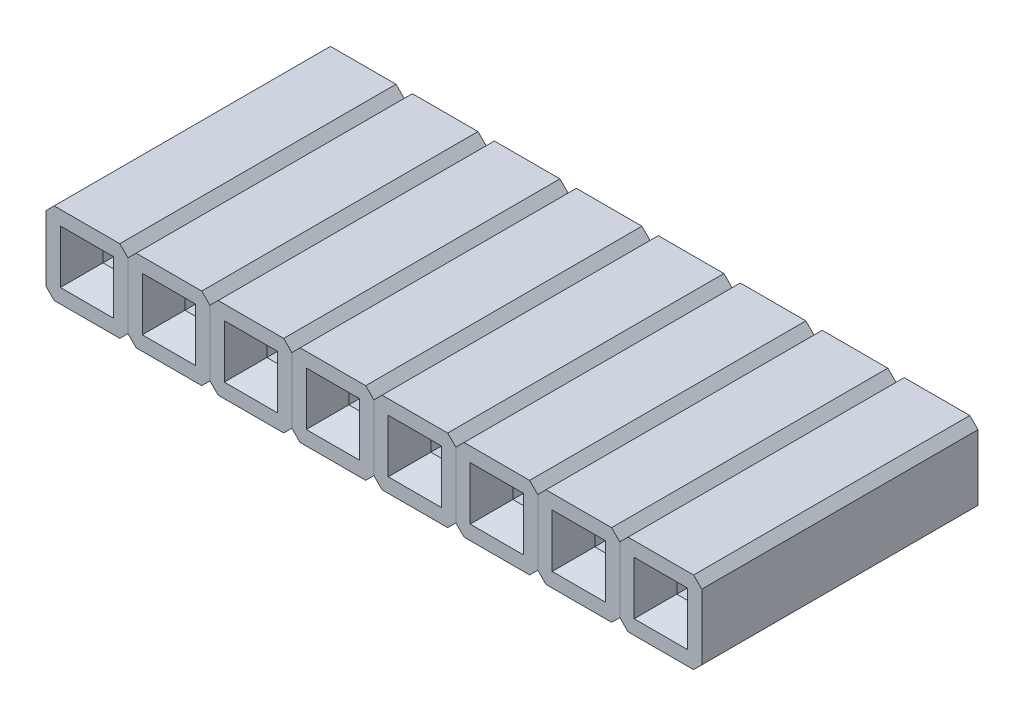
from build123d import *

# Parameters (mm, degrees)
SKETCH1_W           = 2.54
SKETCH1_H           = 2.54
BOSS_EXTRUDE1_DEPTH = 8.5598
SKETCH2_W           = 0.635
SKETCH2_H           = 0.635
CUT_EXTRUDE1_DEPTH  = 6.35
CHAMFER1_SIZE       = 0.508
CHAMFER1_SIZE2      = 0.812969941
CHAMFER2_SIZE       = 0.254
LPATTERN1_COUNT     = 8
LPATTERN1_PITCH     = 2.54


with BuildPart() as part:
    # Sketch1 → Boss-Extrude1 (new body)
    with BuildSketch(Plane.XY):
        with Locations((1.27, 1.27)):
            Rectangle(SKETCH1_W, SKETCH1_H)
    extrude(amount=BOSS_EXTRUDE1_DEPTH)

    # Sketch2 → Cut-Extrude1 (cut)
    with BuildSketch(Plane.XY.offset(8.5598)):
        with Locations((1.27, 1.27)):
            Rectangle(SKETCH2_W, SKETCH2_H)
    extrude(amount=-CUT_EXTRUDE1_DEPTH, mode=Mode.SUBTRACT)

    # Chamfer1
    chamfer1_edges = [part.edges().sort_by_distance(p)[0] for p in [
        (1.5875, 1.27, 8.5598),
        (1.27, 1.5875, 8.5598),
        (0.9525, 1.27, 8.5598),
        (1.27, 0.9525, 8.5598),
    ]]
    chamfer1_side = [part.faces().sort_by_distance(p)[0] for p in [
        (1.27, 0.035921024, 8.5598),
    ]]
    chamfer(chamfer1_edges, length=CHAMFER1_SIZE, length2=CHAMFER1_SIZE2, reference=chamfer1_side[0])

    # Chamfer2
    chamfer2_edges = [part.edges().sort_by_distance(p)[0] for p in [
        (0, 2.54, 4.2799),
        (2.54, 2.54, 4.2799),
        (2.54, 0, 4.2799),
        (0, 0, 4.2799),
    ]]
    chamfer(chamfer2_edges, length=CHAMFER2_SIZE)


with BuildPart() as lpattern1_1:
    # LPattern1: pattern copy
    add(part.part.moved(Location(Vector(-1, 0, 0) * (1 * LPATTERN1_PITCH))))


with BuildPart() as lpattern1_2:
    # LPattern1: pattern copy
    add(part.part.moved(Location(Vector(-1, 0, 0) * (2 * LPATTERN1_PITCH))))


with BuildPart() as lpattern1_3:
    # LPattern1: pattern copy
    add(part.part.moved(Location(Vector(-1, 0, 0) * (3 * LPATTERN1_PITCH))))


with BuildPart() as lpattern1_4:
    # LPattern1: pattern copy
    add(part.part.moved(Location(Vector(-1, 0, 0) * (4 * LPATTERN1_PITCH))))


with BuildPart() as lpattern1_5:
    # LPattern1: pattern copy
    add(part.part.moved(Location(Vector(-1, 0, 0) * (5 * LPATTERN1_PITCH))))


with BuildPart() as lpattern1_6:
    # LPattern1: pattern copy
    add(part.part.moved(Location(Vector(-1, 0, 0) * (6 * LPATTERN1_PITCH))))


with BuildPart() as lpattern1_7:
    # LPattern1: pattern copy
    add(part.part.moved(Location(Vector(-1, 0, 0) * (7 * LPATTERN1_PITCH))))


solid = Compound([part.part, lpattern1_1.part, lpattern1_2.part, lpattern1_3.part, lpattern1_4.part, lpattern1_5.part, lpattern1_6.part, lpattern1_7.part])
